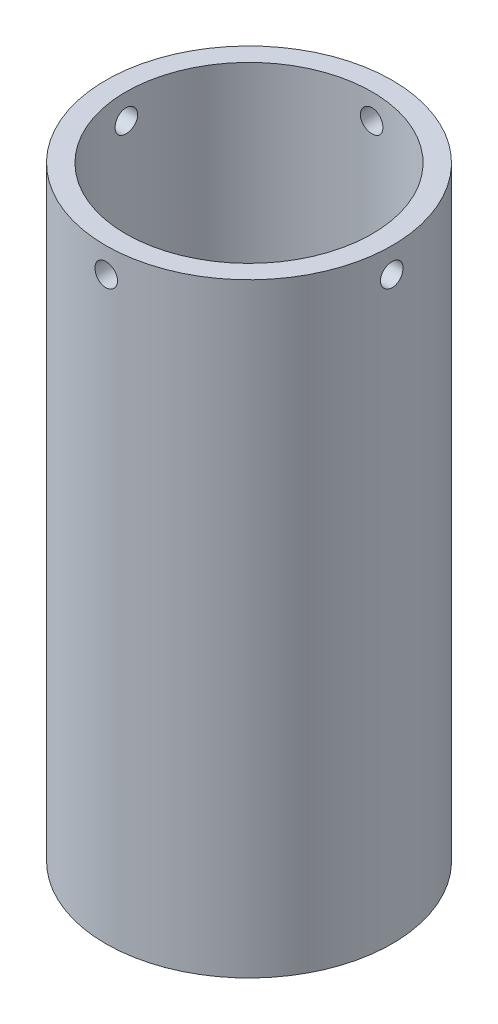
from build123d import *

# Parameters (mm, degrees)
SKETCH1_R           = 28.5
SKETCH1_R_2         = 21
BOSS_EXTRUDE1_DEPTH = 60.675
SKETCH2_R           = 2.25
CUT_EXTRUDE1_DEPTH  = 73.841990809
CIRPATTERN1_COUNT   = 4
CUT_EXTRUDE4_START  = -1
SKETCH5_R           = 28.5
CUT_EXTRUDE4_DEPTH  = 1
SKETCH3_R           = 2.25
CUT_EXTRUDE2_DEPTH  = 6.5
SKETCH4_R           = 24.5
CUT_EXTRUDE3_DEPTH  = 109.85


with BuildPart() as part:
    # Sketch1 → Boss-Extrude1 (new, symmetric)
    with BuildSketch(Plane(origin=(0, 0, 0), x_dir=(1, 0, 0), z_dir=(0, 1, 0))):
        with Locations(Location((0, 0, 0), (0, 0, 270))):
            Circle(SKETCH1_R)
        with Locations(Location((0, 0, 0), (0, 0, 270))):
            Circle(SKETCH1_R_2, mode=Mode.SUBTRACT)
    extrude(amount=BOSS_EXTRUDE1_DEPTH, both=True)

    # Sketch2 → Cut-Extrude1 (cut, through all)
    with BuildSketch(Plane.XY):
        with Locations(Location((0, 55.675, 0), (0, 0, 90))):
            Circle(SKETCH2_R)
    cut_extrude1 = extrude(amount=-CUT_EXTRUDE1_DEPTH, mode=Mode.SUBTRACT)

    # CirPattern1: Cut-Extrude1 ×4 about axis
    cirpattern1_axis = Axis((0, 60.675, 0), (0, -1, 0))
    for i in range(1, CIRPATTERN1_COUNT):
        add(cut_extrude1.rotate(cirpattern1_axis, i * 360 / CIRPATTERN1_COUNT), mode=Mode.SUBTRACT)

    # Sketch5 → Cut-Extrude4 (cut)
    with BuildSketch(Plane.XZ.offset(60.675).offset(CUT_EXTRUDE4_START)):
        with Locations(Location((0, 0, 0), (0, 0, 270))):
            Circle(SKETCH5_R)
    extrude(amount=CUT_EXTRUDE4_DEPTH, mode=Mode.SUBTRACT)

    # Sketch3 → Cut-Extrude2 (cut)
    with BuildSketch(Plane.XZ.offset(59.675)):
        with Locations(Location((0, 24.75, 0), (0, 0, 270))):
            Circle(SKETCH3_R)
        with Locations(Location((24.75, 0, 0), (0, 0, 270))):
            Circle(SKETCH3_R)
        with Locations(Location((0, -24.75, 0), (0, 0, 270))):
            Circle(SKETCH3_R)
        with Locations(Location((-24.75, 0, 0), (0, 0, 270))):
            Circle(SKETCH3_R)
    extrude(amount=-CUT_EXTRUDE2_DEPTH, mode=Mode.SUBTRACT)

    # Sketch4 → Cut-Extrude3 (cut)
    with BuildSketch(Plane(origin=(0, 60.675, 0), x_dir=(1, 0, 0), z_dir=(0, 1, 0))):
        with Locations(Location((0, 0, 0), (0, 0, 270))):
            Circle(SKETCH4_R)
    extrude(amount=-CUT_EXTRUDE3_DEPTH, mode=Mode.SUBTRACT)


solid = part.part
